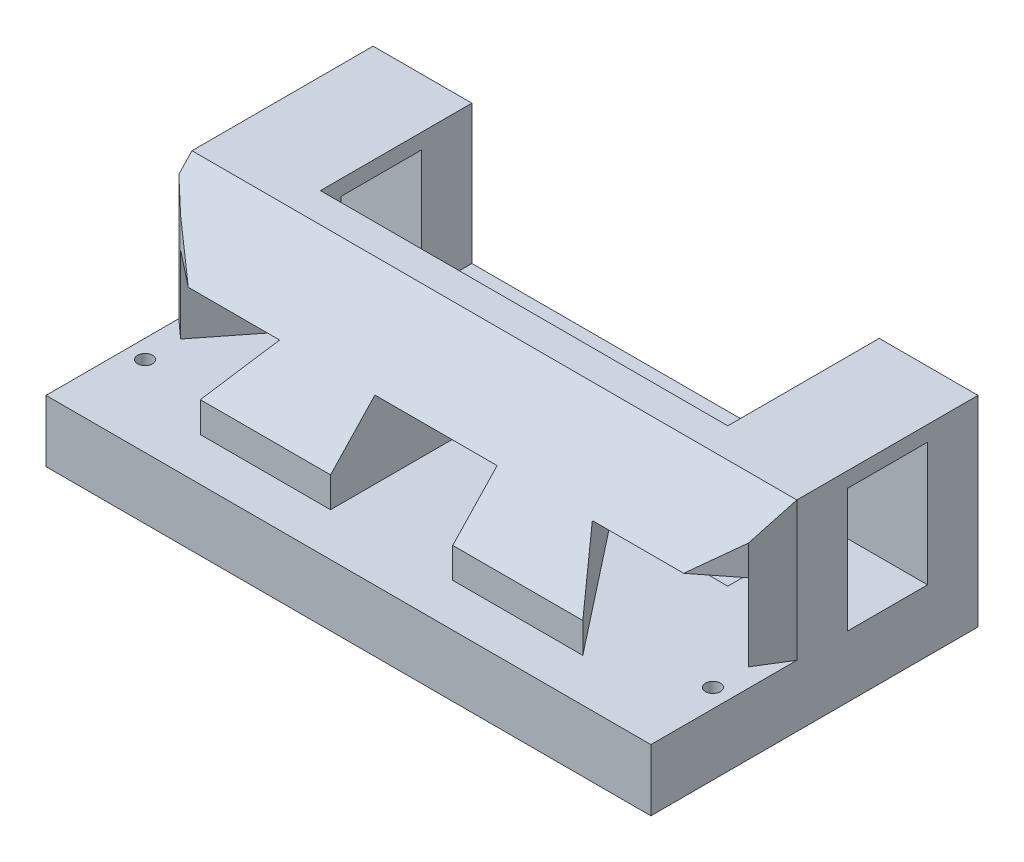
from build123d import *

# Parameters (mm, degrees)
CROQUIS1_W              = 98
CROQUIS1_H              = 53
SALIENTE_EXTRUIR1_DEPTH = 35
CROQUIS2_R              = 1.052356083
CORTAR_EXTRUIR1_DEPTH   = 25
CROQUIS4_R              = 1.21
CORTAR_EXTRUIR2_DEPTH   = 77.456439381
CROQUIS5_R              = 1.21
CORTAR_EXTRUIR3_DEPTH   = 77.456439381
CROQUIS6_W              = 19.087146806
CROQUIS6_H              = 12.5
CORTAR_EXTRUIR4_DEPTH   = 99.715019882
CROQUIS7_W              = 19.109936399
CROQUIS7_H              = 12.5
CORTAR_EXTRUIR5_DEPTH   = 95.352926478
CORTAR_EXTRUIR6_DEPTH   = 83.575081806
CORTAR_EXTRUIR7_DEPTH   = 30
CORTAR_EXTRUIR8_DEPTH   = 110.416374403
CORTAR_EXTRUIR9_DEPTH   = 24
CROQUIS12_W             = 107.668440241
CROQUIS12_H             = 57.968086936
CORTAR_EXTRUIR10_DEPTH  = 2.5
CORTAR_EXTRUIR11_DEPTH  = 109.642500834


with BuildPart() as part:
    # Croquis1 → Saliente-Extruir1 (new body)
    with BuildSketch(Plane(origin=(0, 0, 0), x_dir=(1, 0, 0), z_dir=(0, 1, 0))):
        with Locations((9.971553611, -7.307439825)):
            Rectangle(CROQUIS1_W, CROQUIS1_H)
    extrude(amount=SALIENTE_EXTRUIR1_DEPTH)

    # Croquis2 → Cortar-Extruir1 (cut)
    with BuildSketch(Plane(origin=(0, 35, 0), x_dir=(1, 0, 0), z_dir=(0, 1, 0))):
        Polygon((19.971553611, -26.807439825), (9.971553611, -26.807439825), (-0.028446389, -26.807439825), (-21.028702453, -26.807439825), (-36.028446389, -15.003760101), (-39.028446389, -12.284028263), (-39.028446389, -33.807439825), (58.971553611, -33.807439825), (58.971553611, -10.155599963), (55.971553611, -15.003760101), (40.942820659, -26.807439825), align=None)
        with Locations(Location((-36.028446389, -20.755083742, 0), (0, 0, 270))):
            Circle(CROQUIS2_R, mode=Mode.SUBTRACT)
        with Locations(Location((55.971553611, -20.755083742, 0), (0, 0, 270))):
            Circle(CROQUIS2_R, mode=Mode.SUBTRACT)
    extrude(amount=-CORTAR_EXTRUIR1_DEPTH, mode=Mode.SUBTRACT)

    # Croquis4 → Cortar-Extruir2 (cut, through all)
    with BuildSketch(Plane(origin=(0, 35, 0), x_dir=(1, 0, 0), z_dir=(0, 1, 0))):
        with Locations(Location((-36.028446389, -20.755083742, 0), (0, 0, 270))):
            Circle(CROQUIS4_R)
    extrude(amount=-CORTAR_EXTRUIR2_DEPTH, mode=Mode.SUBTRACT)

    # Croquis5 → Cortar-Extruir3 (cut, through all)
    with BuildSketch(Plane(origin=(0, 35, 0), x_dir=(1, 0, 0), z_dir=(0, 1, 0))):
        with Locations(Location((55.971553611, -20.755083742, 0), (0, 0, 270))):
            Circle(CROQUIS5_R)
    extrude(amount=-CORTAR_EXTRUIR3_DEPTH, mode=Mode.SUBTRACT)

    # Croquis6 → Cortar-Extruir4 (cut, through all)
    with BuildSketch(Plane(origin=(-21.069927214, 0, 26.774999013), x_dir=(0.7858557430790737, 0, 0.6184098568664935), z_dir=(-0.6184098568664935, 0, 0.7858557430790737))):
        with Locations((-9.49111497, 16.25)):
            Rectangle(CROQUIS6_W, CROQUIS6_H)
    extrude(amount=-CORTAR_EXTRUIR4_DEPTH, mode=Mode.SUBTRACT)

    # Croquis7 → Cortar-Extruir5 (cut, through all)
    with BuildSketch(Plane(origin=(28.642438973, 0, 36.468251975), x_dir=(0.7864355295732114, 0, -0.6176723709418307), z_dir=(0.6176723709418307, 0, 0.7864355295732114))):
        with Locations((25.195642131, 16.25)):
            Rectangle(CROQUIS7_W, CROQUIS7_H)
    extrude(amount=-CORTAR_EXTRUIR5_DEPTH, mode=Mode.SUBTRACT)

    # Croquis8 → Cortar-Extruir6 (cut, through all)
    with BuildSketch(Plane.XY.offset(26.807439825)):
        Polygon((9.971553611, 10), (0.071553611, 10), (0.071553611, 22.5), (9.971553611, 22.5), (19.871553611, 22.5), (19.871553611, 10), align=None)
    extrude(amount=-CORTAR_EXTRUIR6_DEPTH, mode=Mode.SUBTRACT)

    # Croquis9 → Cortar-Extruir7 (cut)
    with BuildSketch(Plane(origin=(0, 35, 0), x_dir=(1, 0, 0), z_dir=(0, 1, 0))):
        Polygon((9.971553611, 15.192560175), (42.971553611, 15.192560175), (42.971553611, -5.347439825), (9.971553611, -5.347439825), (-23.028446389, -5.347439825), (-23.028446389, 15.192560175), align=None)
    extrude(amount=-CORTAR_EXTRUIR7_DEPTH, mode=Mode.SUBTRACT)

    # Croquis10 → Cortar-Extruir8 (cut, through all)
    with BuildSketch(Plane(origin=(58.971553611, 0, 0), x_dir=(0, 0, -1), z_dir=(1, 0, 0))):
        Polygon((4.518480106, 10), (11.018480106, 10), (11.018480106, 30.02), (4.518480106, 30.02), (-1.981519894, 30.02), (-1.981519894, 10), align=None)
    extrude(amount=-CORTAR_EXTRUIR8_DEPTH, mode=Mode.SUBTRACT)

    # Croquis11 → Cortar-Extruir9 (cut)
    with BuildSketch(Plane(origin=(0, 0, -19.192560175), x_dir=(-1, 0, 0), z_dir=(0, 0, -1))):
        Polygon((-9.971553611, 35), (23.028446389, 35), (23.028446389, 10), (-9.971553611, 10), (-42.971553611, 10), (-42.971553611, 35), align=None)
    extrude(amount=-CORTAR_EXTRUIR9_DEPTH, mode=Mode.SUBTRACT)

    # Croquis12 → Cortar-Extruir10 (cut)
    with BuildSketch(Plane(origin=(0, 35, 0), x_dir=(1, 0, 0), z_dir=(0, 1, 0))):
        with Locations((11.756632462, -7.871148936)):
            Rectangle(CROQUIS12_W, CROQUIS12_H)
    extrude(amount=-CORTAR_EXTRUIR10_DEPTH, mode=Mode.SUBTRACT)

    # Croquis13 → Cortar-Extruir11 (cut, through all)
    with BuildSketch(Plane(origin=(58.971553611, 0, 0), x_dir=(0, 0, -1), z_dir=(1, 0, 0))):
        Polygon((-33.807439825, 32.5), (-33.807439825, 10), (-31.442255839, 10), (-10.155599963, 32.5), align=None)
    extrude(amount=-CORTAR_EXTRUIR11_DEPTH, mode=Mode.SUBTRACT)


solid = part.part
